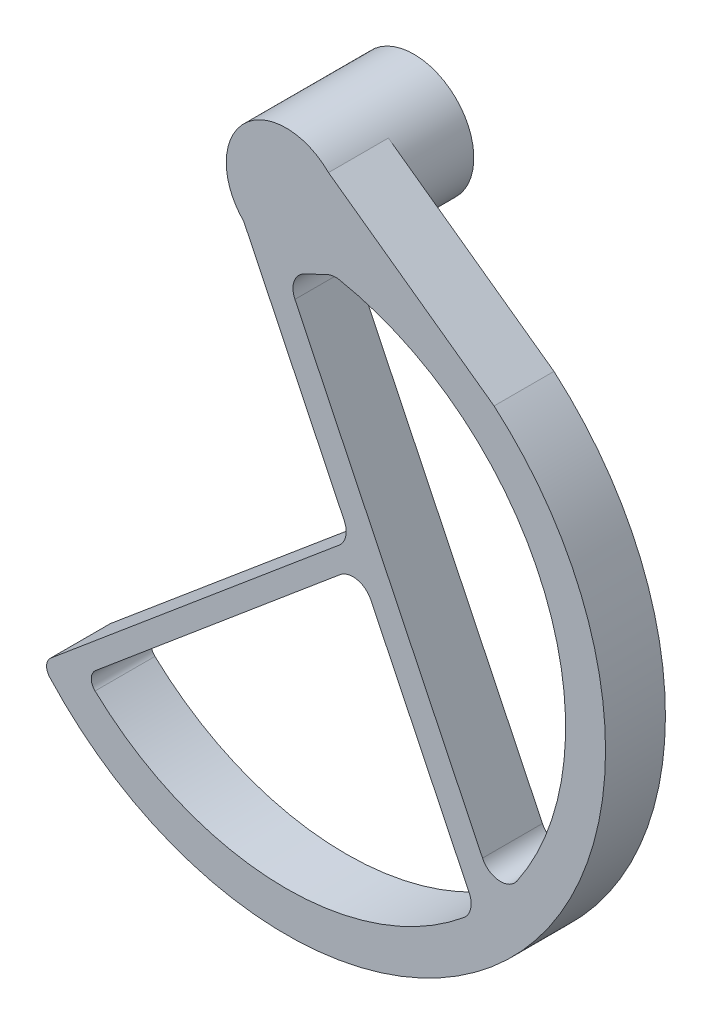
from build123d import *

# Parameters (mm, degrees)
EXTRUDE_1_DEPTH     = 15
CUT_EXTRUDE_START   = -15
CUT_EXTRUDE_1_DEPTH = 15
EXTRUDE_START       = 17
SKETCH_11_R         = 15
EXTRUDE_3_DEPTH     = 17
SKETCH_12_R         = 10.1
CUT_EXTRUDE_5_DEPTH = 2


with BuildPart() as part:
    # ｽｹｯﾁ4 → ﾎﾞｽ - 押し出し1 (new body)
    with BuildSketch(Plane.XY):
        with BuildLine():
            Line((-53.623111018, -124.995132678), (-58.940636287, -129.45706617))
            ThreePointArc((-58.940636287, -129.45706617), (-60.005384698, -131.552012131), (-59.233530865, -133.771635843))
            ThreePointArc((-59.233530865, -133.771635843), (57.362306223, -135.763481103), (52.076178918, -19.270504783))
            Line((52.076178918, -19.270504783), (10.606601718, 10.606601718))
            ThreePointArc((10.606601718, 10.606601718), (-10.606601718, 10.606601718), (-10.606601718, -10.606601718))
            Line((-10.606601718, -10.606601718), (14.536280154, -62.889638219))
            ThreePointArc((14.536280154, -62.889638219), (14.918089499, -66.109676181), (13.244185189, -68.886809092))
            Line((13.244185189, -68.886809092), (-53.623111018, -124.995132678))
        make_face()
        with BuildLine():
            Line((21.232400696, -76.813798404), (45.844843506, -127.993820346))
            ThreePointArc((45.844843506, -127.993820346), (46.221944165, -131.235480845), (44.518718993, -134.019289696))
            ThreePointArc((44.518718993, -134.019289696), (-2.231208213, -149.964431749), (-47.870174388, -131.072951785))
            ThreePointArc((-47.870174388, -131.072951785), (-48.817477846, -128.802229421), (-47.747678417, -126.586582094))
            Line((-47.747678417, -126.586582094), (13.511229465, -75.151532228))
            ThreePointArc((13.511229465, -75.151532228), (17.77869109, -74.092739753), (21.232400696, -76.813798404))
        make_face(mode=Mode.SUBTRACT)
    extrude(amount=EXTRUDE_1_DEPTH)

    # ｽｹｯﾁ6 → ｶｯﾄ - 押し出し1 (cut)
    with BuildSketch(Plane.XY.offset(15).offset(CUT_EXTRUDE_START)):
        with BuildLine():
            Line((49.189589797, -118.797265215), (2.201751786, -21.089020696))
            ThreePointArc((2.201751786, -21.089020696), (1.989274209, -17.268089629), (4.540836142, -14.416039025))
            Line((4.540836142, -14.416039025), (6.483415605, -13.48185369))
            Line((6.483415605, -13.48185369), (10.219658847, -11.685096486))
            ThreePointArc((10.219658847, -11.685096486), (11.747077013, -11.232198087), (13.339423466, -11.282754846))
            ThreePointArc((13.339423466, -11.282754846), (64.738421392, -53.37413296), (57.826055334, -119.448033215))
            ThreePointArc((57.826055334, -119.448033215), (53.319931874, -121.616182211), (49.189589797, -118.797265215))
        make_face()
    extrude(amount=CUT_EXTRUDE_1_DEPTH, mode=Mode.SUBTRACT)

    # ｽｹｯﾁ11 → ﾎﾞｽ - 押し出し3 (add)
    with BuildSketch(Plane(origin=(0, 0, 0), x_dir=(-1, 0, 0), z_dir=(0, 0, -1)).offset(EXTRUDE_START)):
        Circle(SKETCH_11_R)
    extrude(amount=-EXTRUDE_3_DEPTH)

    # ｽｹｯﾁ12 → ｶｯﾄ - 押し出し5 (cut)
    with BuildSketch(Plane(origin=(0, 0, -17), x_dir=(-1, 0, 0), z_dir=(0, 0, -1))):
        Circle(SKETCH_12_R)
    extrude(amount=-CUT_EXTRUDE_5_DEPTH, mode=Mode.SUBTRACT)


solid = part.part
